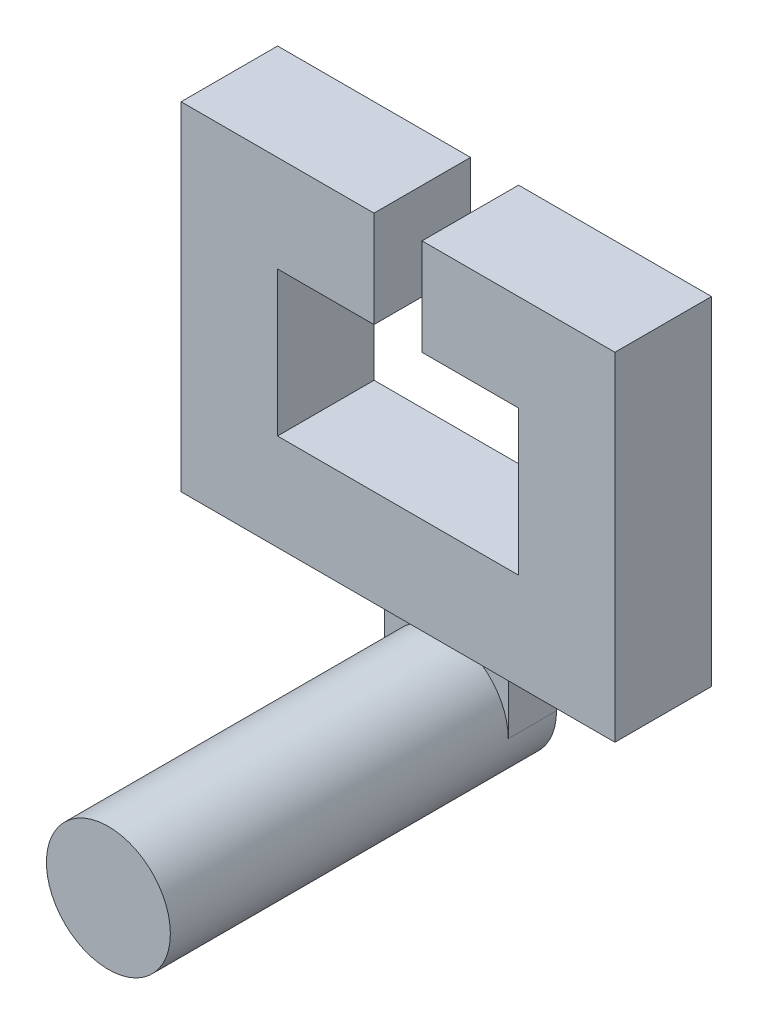
from build123d import *

# Parameters (mm, degrees)
SKETCH1_R       = 16.3068
FEATURE_A_DEPTH = 101.6
SKETCH2_W       = 32.6136
SKETCH2_H       = 12.7
FEATURE_B_DEPTH = 25.908
SKETCH3_W       = 63.3984
SKETCH3_H       = 25.4
FEATURE_C_DEPTH = 25.4
SKETCH4_W       = 25.4
SKETCH4_H       = 63.4746
FEATURE_D_DEPTH = 25.3746
SKETCH5_W       = 50.75428
SKETCH5_H       = 25.4
FEATURE_E_DEPTH = 25.4


with BuildPart() as part:
    # Sketch1 → Feature A (new body)
    with BuildSketch(Plane.XY):
        Circle(SKETCH1_R)
    extrude(amount=FEATURE_A_DEPTH)

    # Sketch2 → Feature B (add)
    with BuildSketch(Plane(origin=(0, 0, 0), x_dir=(1, 0, 0), z_dir=(0, 1, 0))):
        with Locations((0, -6.35)):
            Rectangle(SKETCH2_W, SKETCH2_H)
    extrude(amount=FEATURE_B_DEPTH)

    # Sketch3 → Feature C (add)
    with BuildSketch(Plane(origin=(0, 25.908, 0), x_dir=(1, 0, 0), z_dir=(0, 1, 0))):
        with Locations((0, -12.7)):
            Rectangle(SKETCH3_W, SKETCH3_H)
    feature_c = extrude(amount=FEATURE_C_DEPTH)

    # Sketch4 → Feature D (add)
    with BuildSketch(Plane(origin=(31.6992, 0, 0), x_dir=(0, 0, -1), z_dir=(1, 0, 0))):
        with Locations((-12.7, 57.6453)):
            Rectangle(SKETCH4_W, SKETCH4_H)
    feature_d = extrude(amount=FEATURE_D_DEPTH)

    # Sketch5 → Feature E (add)
    with BuildSketch(Plane(origin=(0, 89.3826, 0), x_dir=(1, 0, 0), z_dir=(0, 1, 0))):
        with Locations((31.69666, -12.7)):
            Rectangle(SKETCH5_W, SKETCH5_H)
    feature_e = extrude(amount=FEATURE_E_DEPTH)

    # Mirror6: Feature C, Feature D, Feature E across plane
    add(feature_c.mirror(Plane.ZY))
    add(feature_d.mirror(Plane.ZY))
    add(feature_e.mirror(Plane.ZY))


solid = part.part
